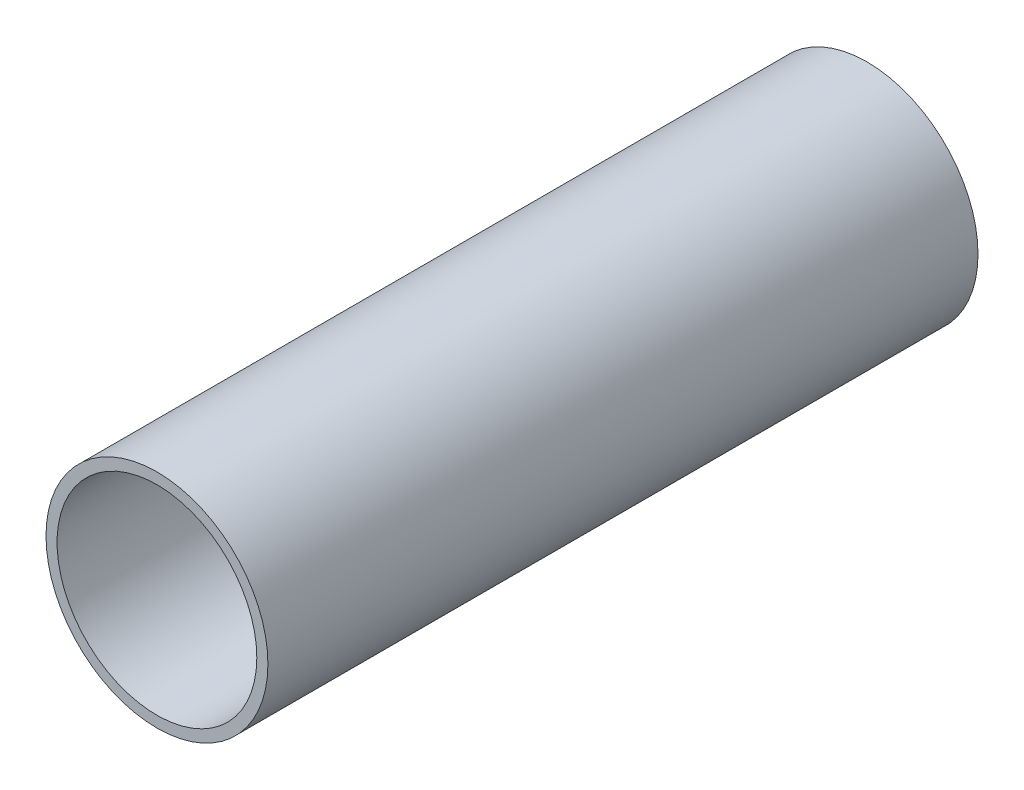
from build123d import *

# Parameters (mm, degrees)
SKETCH_1_R      = 10
SKETCH_1_R_2    = 9
EXTRUDE_1_DEPTH = 64


with BuildPart() as part:
    # 草图1 → 凸台-拉伸1 (new body)
    with BuildSketch(Plane.XY):
        Circle(SKETCH_1_R)
        Circle(SKETCH_1_R_2, mode=Mode.SUBTRACT)
    extrude(amount=EXTRUDE_1_DEPTH)


solid = part.part
